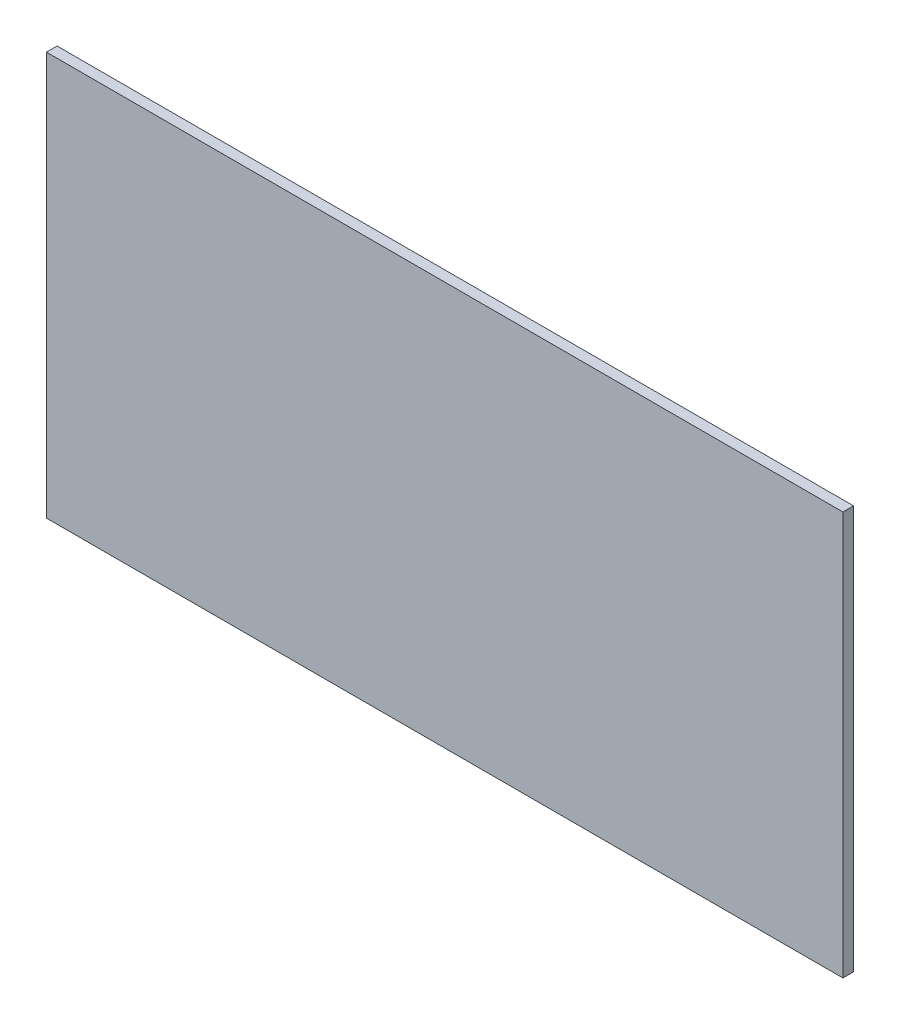
from build123d import *

# Parameters (mm, degrees)
SKETCH1_W           = 75
SKETCH1_H           = 38
BOSS_EXTRUDE1_DEPTH = 1


with BuildPart() as part:
    # Sketch1 → Boss-Extrude1 (new body)
    with BuildSketch(Plane.XY):
        Rectangle(SKETCH1_W, SKETCH1_H)
    extrude(amount=BOSS_EXTRUDE1_DEPTH)


solid = part.part
